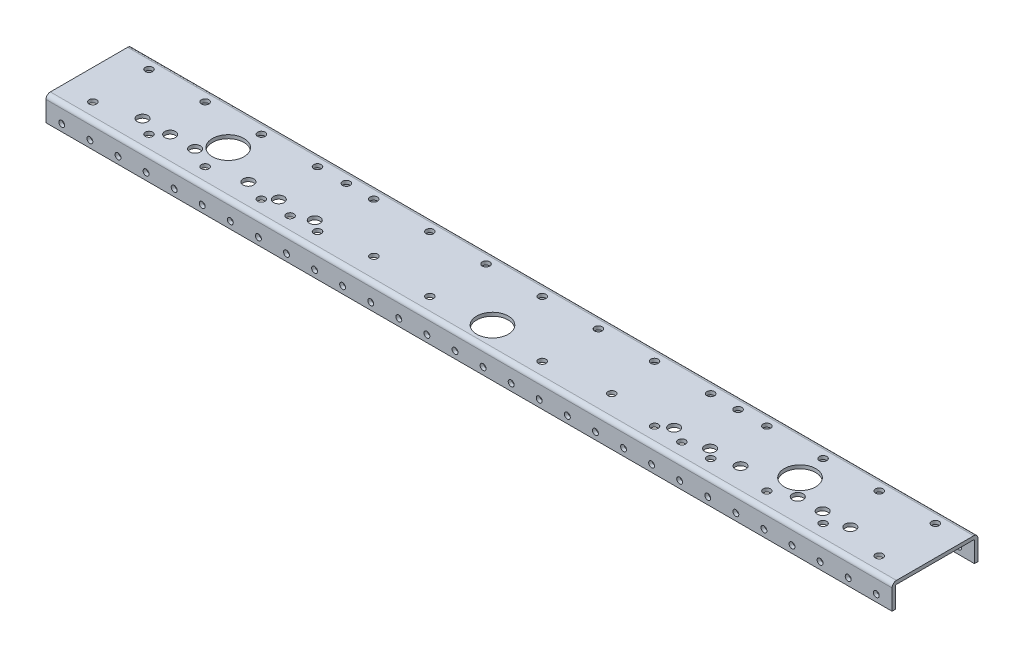
from build123d import *

# Parameters (mm, degrees)
SKETCH1_W                  = 812.8
SKETCH1_H                  = 77.724
BOSS_EXTRUDE1_DEPTH        = 22.225
SKETCH2_W                  = 71.374
SKETCH2_H                  = 19.05
CUT_EXTRUDE1_DEPTH         = 817.364663535
HOLE1_D                    = 9.652
HOLE2_D                    = 28.575
H_0_266_DIAMETER_HOLE1_D   = 6.7564
F_10_CLEARANCE_HOLE1_D     = 5.334
F_10_CLEARANCE_HOLE1_DEPTH = 3.175
F_10_CLEARANCE_HOLE2_D     = 5.334
F_10_CLEARANCE_HOLE2_DEPTH = 3.175
F_10_CLEARANCE_HOLE3_D     = 5.334
CHAMFER1_SIZE              = 3.175
FILLET1_R                  = 0.762
FILLET2_R                  = 3.937
SKETCH15_W                 = 23.8125
SKETCH15_H                 = 77.724
CUT_EXTRUDE2_DEPTH         = 817.444922817


with BuildPart() as part:
    # Sketch1 → Boss-Extrude1 (new body)
    with BuildSketch(Plane.XZ.offset(19.05)):
        with Locations((406.4, -34.925)):
            Rectangle(SKETCH1_W, SKETCH1_H)
    extrude(amount=-BOSS_EXTRUDE1_DEPTH)

    # Sketch2 → Cut-Extrude1 (cut, through all)
    with BuildSketch(Plane.ZY):
        with Locations((-34.925, -9.525)):
            Rectangle(SKETCH2_W, SKETCH2_H)
    extrude(amount=-CUT_EXTRUDE1_DEPTH, mode=Mode.SUBTRACT)

    # Hole1 (through all)
    with Locations(Plane(origin=(0, 0, 0), x_dir=(-1, 0, 0), z_dir=(0, -1, 0))):
        with Locations((-568.924874752, 19.05), (-601.438495912, 19.05), (-628.947697627, 19.05), (-243.875125248, 19.05), (-211.361504088, 19.05), (-183.852302373, 19.05), (-678.944202666, 20.828), (-701.450372003, 20.828), (-726.460886343, 20.828), (-133.855797334, 20.828), (-111.349627997, 20.828), (-86.339113657, 20.828)):
            Hole(HOLE1_D / 2)

    # Hole2 (through all)
    with Locations(Plane(origin=(0, 0, 0), x_dir=(-1, 0, 0), z_dir=(0, -1, 0))):
        with Locations((-664.970837168, 36.83), (-147.829162832, 36.83), (-406.4, 17.272)):
            Hole(HOLE2_D / 2)

    # H (0.266) Diameter Hole1 (through all)
    with Locations(Plane(origin=(0, 0, 0), x_dir=(-1, 0, 0), z_dir=(0, -1, 0))):
        with Locations((-762, 11.43), (-762, 62.23), (-711.2, 11.43), (-711.2, 62.23), (-660.4, 11.43), (-660.4, 62.23), (-609.6, 11.43), (-609.6, 62.23), (-558.8, 11.43), (-558.8, 62.23), (-152.4, 11.43), (-203.2, 62.23), (-203.2, 11.43), (-254, 62.23), (-50.8, 11.43), (-101.6, 62.23), (-101.6, 11.43), (-152.4, 62.23), (-254, 11.43), (-304.8, 62.23), (-355.6, 62.23), (-355.6, 11.43), (-508, 62.23), (-457.2, 11.43), (-457.2, 62.23), (-406.4, 62.23), (-50.8, 62.23), (-583.538437168, 62.23), (-583.538437168, 11.43), (-229.261562832, 11.43), (-229.261562832, 62.23), (-513.925467617, 17.547282407), (-298.874532383, 17.547282407)):
            Hole(H_0_266_DIAMETER_HOLE1_D / 2)

    # #10 Clearance Hole1
    with Locations(Plane(origin=(0, 0, 0.762), x_dir=(-1, 0, 0), z_dir=(0, 0, -1))):
        with Locations((-12.7, -12.7), (-800.1, -12.7)):
            Hole(F_10_CLEARANCE_HOLE1_D / 2, depth=F_10_CLEARANCE_HOLE1_DEPTH)

    # #10 Clearance Hole2
    with Locations(Plane.XY.offset(3.937)):
        with Locations((63.5, -12.7), (38.1, -12.7), (88.9, -12.7), (114.3, -12.7), (139.7, -12.7), (165.1, -12.7), (190.5, -12.7), (215.9, -12.7), (241.3, -12.7), (266.7, -12.7), (292.1, -12.7), (317.5, -12.7), (342.9, -12.7), (368.3, -12.7), (393.7, -12.7), (419.1, -12.7), (444.5, -12.7), (469.9, -12.7), (495.3, -12.7), (520.7, -12.7), (546.1, -12.7), (571.5, -12.7), (596.9, -12.7), (622.3, -12.7), (647.7, -12.7), (673.1, -12.7), (698.5, -12.7), (723.9, -12.7), (749.3, -12.7), (774.7, -12.7)):
            Hole(F_10_CLEARANCE_HOLE2_D / 2, depth=F_10_CLEARANCE_HOLE2_DEPTH)

    # #10 Clearance Hole3 (through all)
    with Locations(Plane.XY.offset(-70.612)):
        with Locations((800.1, -12.7), (774.7, -12.7), (749.3, -12.7), (723.9, -12.7), (698.5, -12.7), (673.1, -12.7), (647.7, -12.7), (622.3, -12.7), (596.9, -12.7), (571.5, -12.7), (546.1, -12.7), (520.7, -12.7), (495.3, -12.7), (469.9, -12.7), (444.5, -12.7), (419.1, -12.7), (393.7, -12.7), (368.3, -12.7), (342.9, -12.7), (317.5, -12.7), (292.1, -12.7), (266.7, -12.7), (241.3, -12.7), (215.9, -12.7), (190.5, -12.7), (165.1, -12.7), (139.7, -12.7), (114.3, -12.7), (88.9, -12.7), (63.5, -12.7), (38.1, -12.7), (12.7, -12.7)):
            Hole(F_10_CLEARANCE_HOLE3_D / 2)

    # Chamfer1
    chamfer1_edges = [part.edges().sort_by_distance(p)[0] for p in [
        (812.8, -19.05, 2.3495),
        (0, -19.05, -72.1995),
        (0, -19.05, 2.3495),
        (812.8, -19.05, -72.1995),
    ]]
    chamfer(chamfer1_edges, length=CHAMFER1_SIZE)

    # Fillet1
    fillet1_edges = [part.edges().sort_by_distance(p)[0] for p in [
        (406.4, 0, -70.612),
        (406.4, 0, 0.762),
    ]]
    fillet(fillet1_edges, radius=FILLET1_R)

    # Fillet2
    fillet2_edges = [part.edges().sort_by_distance(p)[0] for p in [
        (406.4, 3.175, -73.787),
        (406.4, 3.175, 3.937),
    ]]
    fillet(fillet2_edges, radius=FILLET2_R)

    # Sketch15 → Cut-Extrude2 (cut, through all)
    with BuildSketch(Plane(origin=(0, 3.175, 0), x_dir=(1, 0, 0), z_dir=(0, 1, 0))):
        with Locations((800.89375, 34.925)):
            Rectangle(SKETCH15_W, SKETCH15_H)
        with Locations((11.90625, 34.925)):
            Rectangle(SKETCH15_W, SKETCH15_H)
    extrude(amount=-CUT_EXTRUDE2_DEPTH, mode=Mode.SUBTRACT)


solid = part.part
